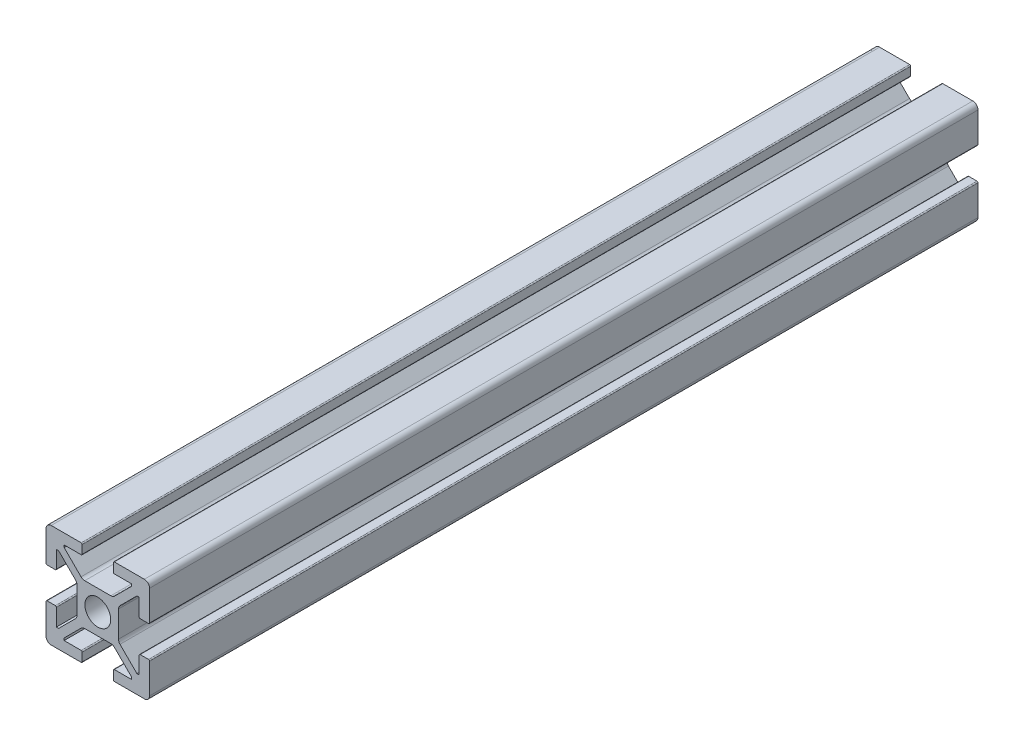
from build123d import *

# Parameters (mm, degrees)
SKETCH1_R           = 2.5
BOSS_EXTRUDE1_DEPTH = 160


with BuildPart() as part:
    # Sketch1 → Boss-Extrude1 (new body)
    with BuildSketch(Plane.XY):
        with BuildLine():
            Line((0.2, 13), (1.8, 13))
            ThreePointArc((1.8, 13), (1.941421356, 13.058578644), (2, 13.2))
            Line((2, 13.2), (2, 16.5))
            Line((2, 16.5), (2.439339828, 16.5))
            Line((2.439339828, 16.5), (5.707106781, 13.232233047))
            ThreePointArc((5.707106781, 13.232233047), (5.923879533, 12.907809698), (6, 12.525126266))
            Line((6, 12.525126266), (6, 7.474873734))
            ThreePointArc((6, 7.474873734), (5.923879533, 7.092190302), (5.707106781, 6.767766953))
            Line((5.707106781, 6.767766953), (2.439339828, 3.5))
            Line((2.439339828, 3.5), (2, 3.5))
            Line((2, 3.5), (2, 6.8))
            ThreePointArc((2, 6.8), (1.941421356, 6.941421356), (1.8, 7))
            Line((1.8, 7), (0.2, 7))
            ThreePointArc((0.2, 7), (0.058578644, 6.941421356), (0, 6.8))
            Line((0, 6.8), (0, 1))
            ThreePointArc((0, 1), (0.292893219, 0.292893219), (1, 0))
            Line((1, 0), (6.8, 0))
            ThreePointArc((6.8, 0), (6.941421356, 0.058578644), (7, 0.2))
            Line((7, 0.2), (7, 1.8))
            ThreePointArc((7, 1.8), (6.941421356, 1.941421356), (6.8, 2))
            Line((6.8, 2), (3.5, 2))
            Line((3.5, 2), (3.5, 2.439339828))
            Line((3.5, 2.439339828), (6.767766953, 5.707106781))
            ThreePointArc((6.767766953, 5.707106781), (7.092190302, 5.923879533), (7.474873734, 6))
            Line((7.474873734, 6), (10, 6))
            Line((10, 6), (12.525126266, 6))
            ThreePointArc((12.525126266, 6), (12.907809698, 5.923879533), (13.232233047, 5.707106781))
            Line((13.232233047, 5.707106781), (16.5, 2.439339828))
            Line((16.5, 2.439339828), (16.5, 2))
            Line((16.5, 2), (13.2, 2))
            ThreePointArc((13.2, 2), (13.058578644, 1.941421356), (13, 1.8))
            Line((13, 1.8), (13, 0.2))
            ThreePointArc((13, 0.2), (13.058578644, 0.058578644), (13.2, 0))
            Line((13.2, 0), (19, 0))
            ThreePointArc((19, 0), (19.707106781, 0.292893219), (20, 1))
            Line((20, 1), (20, 6.8))
            ThreePointArc((20, 6.8), (19.941421356, 6.941421356), (19.8, 7))
            Line((19.8, 7), (18.2, 7))
            ThreePointArc((18.2, 7), (18.058578644, 6.941421356), (18, 6.8))
            Line((18, 6.8), (18, 3.5))
            Line((18, 3.5), (17.560660172, 3.5))
            Line((17.560660172, 3.5), (14.292893219, 6.767766953))
            ThreePointArc((14.292893219, 6.767766953), (14.076120467, 7.092190302), (14, 7.474873734))
            Line((14, 7.474873734), (14, 12.525126266))
            ThreePointArc((14, 12.525126266), (14.076120467, 12.907809698), (14.292893219, 13.232233047))
            Line((14.292893219, 13.232233047), (17.560660172, 16.5))
            Line((17.560660172, 16.5), (18, 16.5))
            Line((18, 16.5), (18, 13.2))
            ThreePointArc((18, 13.2), (18.058578644, 13.058578644), (18.2, 13))
            Line((18.2, 13), (19.8, 13))
            ThreePointArc((19.8, 13), (19.941421356, 13.058578644), (20, 13.2))
            Line((20, 13.2), (20, 19))
            ThreePointArc((20, 19), (19.707106781, 19.707106781), (19, 20))
            Line((19, 20), (13.2, 20))
            ThreePointArc((13.2, 20), (13.058578644, 19.941421356), (13, 19.8))
            Line((13, 19.8), (13, 18.2))
            ThreePointArc((13, 18.2), (13.058578644, 18.058578644), (13.2, 18))
            Line((13.2, 18), (16.5, 18))
            Line((16.5, 18), (16.5, 17.560660172))
            Line((16.5, 17.560660172), (13.232233047, 14.292893219))
            ThreePointArc((13.232233047, 14.292893219), (12.907809698, 14.076120467), (12.525126266, 14))
            Line((12.525126266, 14), (10, 14))
            Line((10, 14), (7.474873734, 14))
            ThreePointArc((7.474873734, 14), (7.092190302, 14.076120467), (6.767766953, 14.292893219))
            Line((6.767766953, 14.292893219), (3.5, 17.560660172))
            Line((3.5, 17.560660172), (3.5, 18))
            Line((3.5, 18), (6.8, 18))
            ThreePointArc((6.8, 18), (6.941421356, 18.058578644), (7, 18.2))
            Line((7, 18.2), (7, 19.8))
            ThreePointArc((7, 19.8), (6.941421356, 19.941421356), (6.8, 20))
            Line((6.8, 20), (1, 20))
            ThreePointArc((1, 20), (0.292893219, 19.707106781), (0, 19))
            Line((0, 19), (0, 13.2))
            ThreePointArc((0, 13.2), (0.058578644, 13.058578644), (0.2, 13))
        make_face()
        with Locations((10, 10)):
            Circle(SKETCH1_R, mode=Mode.SUBTRACT)
    extrude(amount=BOSS_EXTRUDE1_DEPTH)


solid = part.part
